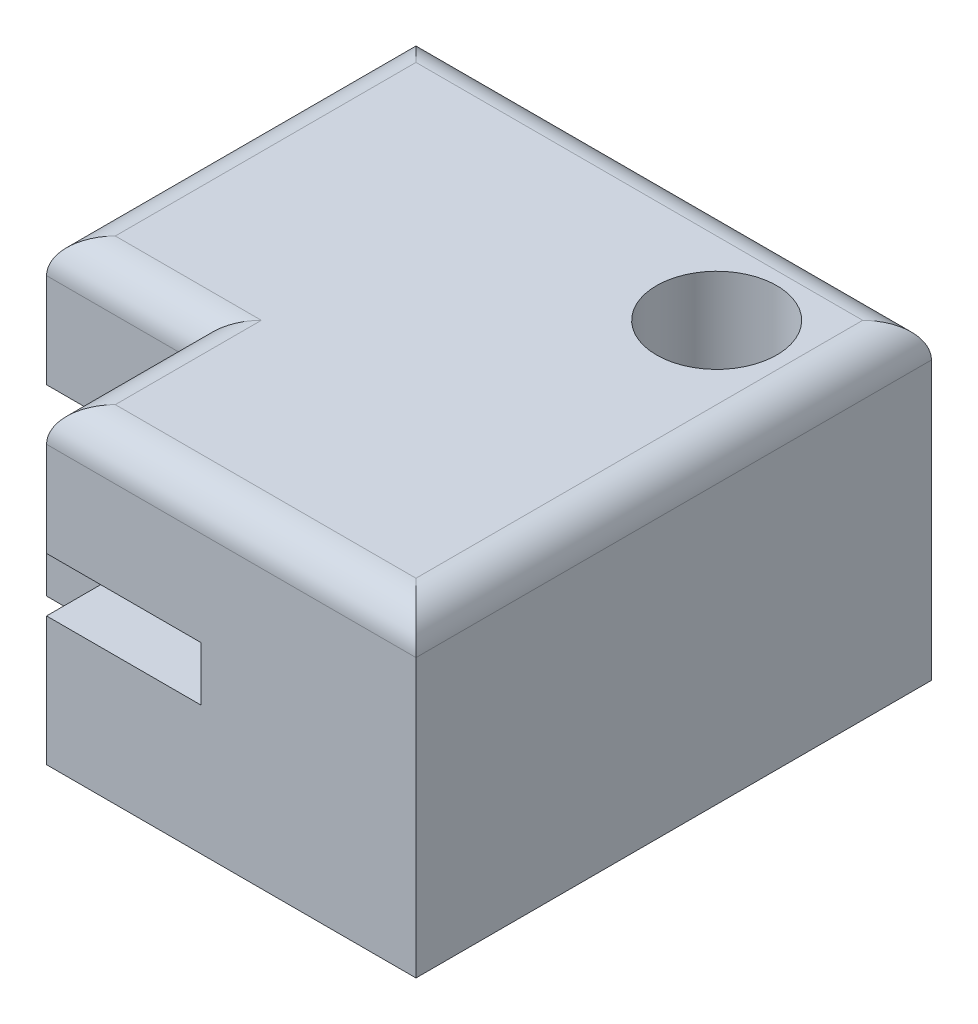
from build123d import *

# Parameters (mm, degrees)
SKETCH1_W           = 15.24
SKETCH1_H           = 15.24
BOSS_EXTRUDE1_DEPTH = 3.81
BOSS_EXTRUDE2_DEPTH = 1.6002
SKETCH3_W           = 15.24
SKETCH3_H           = 15.24
BOSS_EXTRUDE3_DEPTH = 3.81
SKETCH4_W           = 4.318
SKETCH4_H           = 4.318
CUT_EXTRUDE1_DEPTH  = 15.182414746
SKETCH5_R           = 1.778
CUT_EXTRUDE2_DEPTH  = 15.182414746
FILLET1_R           = 1.016


with BuildPart() as part:
    # Sketch1 → Boss-Extrude1 (new body)
    with BuildSketch(Plane(origin=(0, 0, 0), x_dir=(1, 0, 0), z_dir=(0, 1, 0))):
        Rectangle(SKETCH1_W, SKETCH1_H)
    extrude(amount=BOSS_EXTRUDE1_DEPTH)

    # Sketch2 → Boss-Extrude2 (add)
    with BuildSketch(Plane(origin=(0, 3.81, 0), x_dir=(1, 0, 0), z_dir=(0, 1, 0))):
        Polygon((-7.62, 7.62), (-7.62, 1.27), (1.27, 1.27), (1.27, -7.62), (7.62, -7.62), (7.62, 7.62), align=None)
    extrude(amount=BOSS_EXTRUDE2_DEPTH)

    # Sketch3 → Boss-Extrude3 (add)
    with BuildSketch(Plane(origin=(0, 5.4102, 0), x_dir=(1, 0, 0), z_dir=(0, 1, 0))):
        Rectangle(SKETCH3_W, SKETCH3_H)
    extrude(amount=BOSS_EXTRUDE3_DEPTH)

    # Sketch4 → Cut-Extrude1 (cut, through all)
    with BuildSketch(Plane(origin=(0, 9.2202, 0), x_dir=(1, 0, 0), z_dir=(0, 1, 0))):
        with Locations((-5.461, -5.461)):
            Rectangle(SKETCH4_W, SKETCH4_H)
    extrude(amount=-CUT_EXTRUDE1_DEPTH, mode=Mode.SUBTRACT)

    # Sketch5 → Cut-Extrude2 (cut, through all)
    with BuildSketch(Plane(origin=(0, 9.2202, 0), x_dir=(1, 0, 0), z_dir=(0, 1, 0))):
        with Locations(Location((4.445, 4.445, 0), (0, 0, 270))):
            Circle(SKETCH5_R)
    extrude(amount=-CUT_EXTRUDE2_DEPTH, mode=Mode.SUBTRACT)

    # Fillet1
    fillet1_edges = [part.edges().sort_by_distance(p)[0] for p in [
        (7.62, 9.2202, 0),
        (0, 9.2202, -7.62),
        (-7.62, 9.2202, -2.159),
        (2.159, 9.2202, 7.62),
        (-3.302, 9.2202, 5.461),
        (-5.461, 9.2202, 3.302),
    ]]
    fillet(fillet1_edges, radius=FILLET1_R)


solid = part.part
